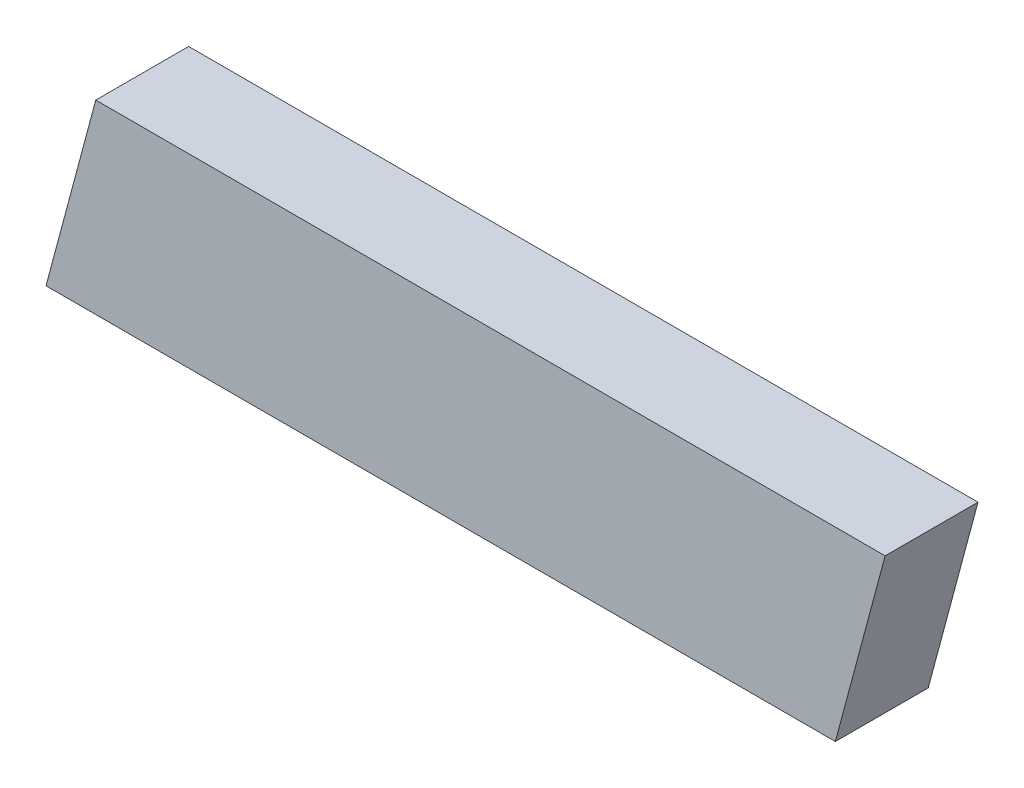
from build123d import *

# Parameters (mm, degrees)
BOSS_EXTRUDE1_DEPTH = 50.8


with BuildPart() as part:
    # Sketch1 → Boss-Extrude1 (new body)
    with BuildSketch(Plane.XY):
        Polygon((0, 0), (27.223637951, 101.6), (459.023637951, 101.6), (431.8, 0), align=None)
    extrude(amount=BOSS_EXTRUDE1_DEPTH)


solid = part.part
